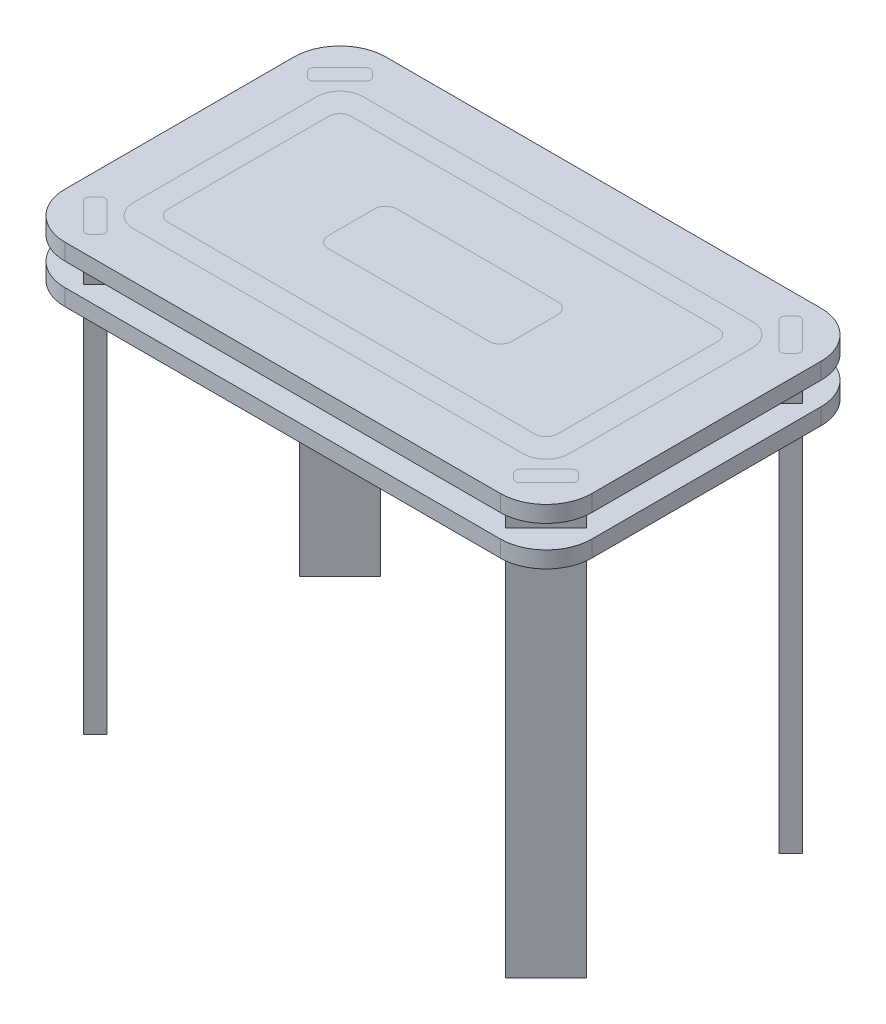
from build123d import *

# Parameters (mm, degrees)
BOSS_EXTRUDE3_DEPTH   = 18.288
BOSS_EXTRUDE3_2_DEPTH = 18.288
BOSS_EXTRUDE4_DEPTH   = 18.288
BOSS_EXTRUDE4_2_DEPTH = 18.288
BOSS_EXTRUDE5_DEPTH   = 18.288
BOSS_EXTRUDE5_2_DEPTH = 18.288
BOSS_EXTRUDE5_3_DEPTH = 18.288
BOSS_EXTRUDE5_4_DEPTH = 18.288
BOSS_EXTRUDE6_DEPTH   = 457.2
BOSS_EXTRUDE6_2_DEPTH = 457.2
BOSS_EXTRUDE6_3_DEPTH = 457.2
BOSS_EXTRUDE6_4_DEPTH = 457.2
BOSS_EXTRUDE7_START   = -18.288
BOSS_EXTRUDE7_DEPTH   = 18.288


with BuildPart() as part:
    # Sketch1 → Boss-Extrude3 (new body)
    with BuildSketch(Plane(origin=(0, 0, 0), x_dir=(1, 0, 0), z_dir=(0, 1, 0))):
        with BuildLine():
            ThreePointArc((0, 50.8), (14.878975516, 14.878975516), (50.8, 0))
            Line((50.8, 0), (533.4, 0))
            ThreePointArc((533.4, 0), (569.321024484, 14.878975516), (584.2, 50.8))
            Line((584.2, 50.8), (584.2, 304.8))
            ThreePointArc((584.2, 304.8), (569.321024484, 340.721024484), (533.4, 355.6))
            Line((533.4, 355.6), (50.8, 355.6))
            ThreePointArc((50.8, 355.6), (14.878975516, 340.721024484), (0, 304.8))
            Line((0, 304.8), (0, 50.8))
        make_face()
        with BuildLine():
            ThreePointArc((57.293126933, 21.372102448), (53.701024484, 19.884204897), (50.108922036, 21.372102448))
            Line((50.108922036, 21.372102448), (21.372102448, 50.108922036))
            ThreePointArc((21.372102448, 50.108922036), (19.884204897, 53.701024484), (21.372102448, 57.293126933))
            Line((21.372102448, 57.293126933), (27.097015726, 63.01804021))
            ThreePointArc((27.097015726, 63.01804021), (30.689118174, 64.505937761), (34.281220622, 63.01804021))
            Line((34.281220622, 63.01804021), (63.01804021, 34.281220622))
            ThreePointArc((63.01804021, 34.281220622), (64.505937761, 30.689118174), (63.01804021, 27.097015726))
            Line((63.01804021, 27.097015726), (57.293126933, 21.372102448))
        make_face(mode=Mode.SUBTRACT)
        with BuildLine():
            Line((526.906873067, 21.372102448), (521.18195979, 27.097015726))
            ThreePointArc((521.18195979, 27.097015726), (519.694062239, 30.689118174), (521.18195979, 34.281220622))
            Line((521.18195979, 34.281220622), (549.918779378, 63.01804021))
            ThreePointArc((549.918779378, 63.01804021), (553.510881826, 64.505937761), (557.102984274, 63.01804021))
            Line((557.102984274, 63.01804021), (562.827897552, 57.293126933))
            ThreePointArc((562.827897552, 57.293126933), (564.315795103, 53.701024484), (562.827897552, 50.108922036))
            Line((562.827897552, 50.108922036), (534.091077964, 21.372102448))
            ThreePointArc((534.091077964, 21.372102448), (530.498975516, 19.884204897), (526.906873067, 21.372102448))
        make_face(mode=Mode.SUBTRACT)
        with BuildLine():
            Line((508, 50.8), (76.2, 50.8))
            ThreePointArc((76.2, 50.8), (58.239487758, 58.239487758), (50.8, 76.2))
            Line((50.8, 76.2), (50.8, 279.4))
            ThreePointArc((50.8, 279.4), (58.239487758, 297.360512242), (76.2, 304.8))
            Line((76.2, 304.8), (508, 304.8))
            ThreePointArc((508, 304.8), (525.960512242, 297.360512242), (533.4, 279.4))
            Line((533.4, 279.4), (533.4, 76.2))
            ThreePointArc((533.4, 76.2), (525.960512242, 58.239487758), (508, 50.8))
        make_face(mode=Mode.SUBTRACT)
        with BuildLine():
            Line((27.097015726, 292.58195979), (21.372102448, 298.306873067))
            ThreePointArc((21.372102448, 298.306873067), (19.884204897, 301.898975516), (21.372102448, 305.491077964))
            Line((21.372102448, 305.491077964), (50.108922036, 334.227897552))
            ThreePointArc((50.108922036, 334.227897552), (53.701024484, 335.715795103), (57.293126933, 334.227897552))
            Line((57.293126933, 334.227897552), (63.01804021, 328.502984274))
            ThreePointArc((63.01804021, 328.502984274), (64.505937761, 324.910881826), (63.01804021, 321.318779378))
            Line((63.01804021, 321.318779378), (34.281220622, 292.58195979))
            ThreePointArc((34.281220622, 292.58195979), (30.689118174, 291.094062239), (27.097015726, 292.58195979))
        make_face(mode=Mode.SUBTRACT)
        with BuildLine():
            ThreePointArc((562.827897552, 305.491077964), (564.315795103, 301.898975516), (562.827897552, 298.306873067))
            Line((562.827897552, 298.306873067), (557.102984274, 292.58195979))
            ThreePointArc((557.102984274, 292.58195979), (553.510881826, 291.094062239), (549.918779378, 292.58195979))
            Line((549.918779378, 292.58195979), (521.18195979, 321.318779378))
            ThreePointArc((521.18195979, 321.318779378), (519.694062239, 324.910881826), (521.18195979, 328.502984274))
            Line((521.18195979, 328.502984274), (526.906873067, 334.227897552))
            ThreePointArc((526.906873067, 334.227897552), (530.498975516, 335.715795103), (534.091077964, 334.227897552))
            Line((534.091077964, 334.227897552), (562.827897552, 305.491077964))
        make_face(mode=Mode.SUBTRACT)
    extrude(amount=BOSS_EXTRUDE3_DEPTH)


with BuildPart() as body_2:
    # Sketch1 → Boss-Extrude3 2 (new body)
    with BuildSketch(Plane(origin=(0, 0, 0), x_dir=(1, 0, 0), z_dir=(0, 1, 0))):
        with BuildLine():
            ThreePointArc((76.2, 88.9), (79.919743879, 79.919743879), (88.9, 76.2))
            Line((88.9, 76.2), (495.3, 76.2))
            ThreePointArc((495.3, 76.2), (504.280256121, 79.919743879), (508, 88.9))
            Line((508, 88.9), (508, 266.7))
            ThreePointArc((508, 266.7), (504.280256121, 275.680256121), (495.3, 279.4))
            Line((495.3, 279.4), (88.9, 279.4))
            ThreePointArc((88.9, 279.4), (79.919743879, 275.680256121), (76.2, 266.7))
            Line((76.2, 266.7), (76.2, 88.9))
        make_face()
        with BuildLine():
            ThreePointArc((190.5, 203.2), (194.219743879, 212.180256121), (203.2, 215.9))
            Line((203.2, 215.9), (381, 215.9))
            ThreePointArc((381, 215.9), (389.980256121, 212.180256121), (393.7, 203.2))
            Line((393.7, 203.2), (393.7, 152.4))
            ThreePointArc((393.7, 152.4), (389.980256121, 143.419743879), (381, 139.7))
            Line((381, 139.7), (203.2, 139.7))
            ThreePointArc((203.2, 139.7), (194.219743879, 143.419743879), (190.5, 152.4))
            Line((190.5, 152.4), (190.5, 203.2))
        make_face(mode=Mode.SUBTRACT)
    extrude(amount=BOSS_EXTRUDE3_2_DEPTH)


with BuildPart() as body_3:
    # Sketch1<6> → Boss-Extrude4 (new body)
    with BuildSketch(Plane(origin=(0, 0, 0), x_dir=(1, 0, 0), z_dir=(0, 1, 0))):
        with BuildLine():
            ThreePointArc((50.8, 76.2), (58.239487758, 58.239487758), (76.2, 50.8))
            Line((76.2, 50.8), (508, 50.8))
            ThreePointArc((508, 50.8), (525.960512242, 58.239487758), (533.4, 76.2))
            Line((533.4, 76.2), (533.4, 279.4))
            ThreePointArc((533.4, 279.4), (525.960512242, 297.360512242), (508, 304.8))
            Line((508, 304.8), (76.2, 304.8))
            ThreePointArc((76.2, 304.8), (58.239487758, 297.360512242), (50.8, 279.4))
            Line((50.8, 279.4), (50.8, 76.2))
        make_face()
        with BuildLine():
            Line((495.3, 76.2), (88.9, 76.2))
            ThreePointArc((88.9, 76.2), (79.919743879, 79.919743879), (76.2, 88.9))
            Line((76.2, 88.9), (76.2, 266.7))
            ThreePointArc((76.2, 266.7), (79.919743879, 275.680256121), (88.9, 279.4))
            Line((88.9, 279.4), (495.3, 279.4))
            ThreePointArc((495.3, 279.4), (504.280256121, 275.680256121), (508, 266.7))
            Line((508, 266.7), (508, 88.9))
            ThreePointArc((508, 88.9), (504.280256121, 79.919743879), (495.3, 76.2))
        make_face(mode=Mode.SUBTRACT)
    extrude(amount=BOSS_EXTRUDE4_DEPTH)


with BuildPart() as body_4:
    # Sketch1<6> → Boss-Extrude4 2 (new body)
    with BuildSketch(Plane(origin=(0, 0, 0), x_dir=(1, 0, 0), z_dir=(0, 1, 0))):
        with BuildLine():
            Line((381, 215.9), (203.2, 215.9))
            ThreePointArc((203.2, 215.9), (194.219743879, 212.180256121), (190.5, 203.2))
            Line((190.5, 203.2), (190.5, 152.4))
            ThreePointArc((190.5, 152.4), (194.219743879, 143.419743879), (203.2, 139.7))
            Line((203.2, 139.7), (381, 139.7))
            ThreePointArc((381, 139.7), (389.980256121, 143.419743879), (393.7, 152.4))
            Line((393.7, 152.4), (393.7, 203.2))
            ThreePointArc((393.7, 203.2), (389.980256121, 212.180256121), (381, 215.9))
        make_face()
    extrude(amount=BOSS_EXTRUDE4_2_DEPTH)


with BuildPart() as body_5:
    # Sketch1<7> → Boss-Extrude5 (new body)
    with BuildSketch(Plane(origin=(0, 0, 0), x_dir=(1, 0, 0), z_dir=(0, 1, 0))):
        with BuildLine():
            ThreePointArc((21.372102448, 305.491077964), (19.884204897, 301.898975516), (21.372102448, 298.306873067))
            Line((21.372102448, 298.306873067), (27.097015726, 292.58195979))
            ThreePointArc((27.097015726, 292.58195979), (30.689118174, 291.094062239), (34.281220622, 292.58195979))
            Line((34.281220622, 292.58195979), (63.01804021, 321.318779378))
            ThreePointArc((63.01804021, 321.318779378), (64.505937761, 324.910881826), (63.01804021, 328.502984274))
            Line((63.01804021, 328.502984274), (57.293126933, 334.227897552))
            ThreePointArc((57.293126933, 334.227897552), (53.701024484, 335.715795103), (50.108922036, 334.227897552))
            Line((50.108922036, 334.227897552), (21.372102448, 305.491077964))
        make_face()
    extrude(amount=BOSS_EXTRUDE5_DEPTH)


with BuildPart() as body_6:
    # Sketch1<7> → Boss-Extrude5 2 (new body)
    with BuildSketch(Plane(origin=(0, 0, 0), x_dir=(1, 0, 0), z_dir=(0, 1, 0))):
        with BuildLine():
            Line((557.102984274, 292.58195979), (562.827897552, 298.306873067))
            ThreePointArc((562.827897552, 298.306873067), (564.315795103, 301.898975516), (562.827897552, 305.491077964))
            Line((562.827897552, 305.491077964), (534.091077964, 334.227897552))
            ThreePointArc((534.091077964, 334.227897552), (530.498975516, 335.715795103), (526.906873067, 334.227897552))
            Line((526.906873067, 334.227897552), (521.18195979, 328.502984274))
            ThreePointArc((521.18195979, 328.502984274), (519.694062239, 324.910881826), (521.18195979, 321.318779378))
            Line((521.18195979, 321.318779378), (549.918779378, 292.58195979))
            ThreePointArc((549.918779378, 292.58195979), (553.510881826, 291.094062239), (557.102984274, 292.58195979))
        make_face()
    extrude(amount=BOSS_EXTRUDE5_2_DEPTH)


with BuildPart() as body_7:
    # Sketch1<7> → Boss-Extrude5 3 (new body)
    with BuildSketch(Plane(origin=(0, 0, 0), x_dir=(1, 0, 0), z_dir=(0, 1, 0))):
        with BuildLine():
            ThreePointArc((521.18195979, 34.281220622), (519.694062239, 30.689118174), (521.18195979, 27.097015726))
            Line((521.18195979, 27.097015726), (526.906873067, 21.372102448))
            ThreePointArc((526.906873067, 21.372102448), (530.498975516, 19.884204897), (534.091077964, 21.372102448))
            Line((534.091077964, 21.372102448), (562.827897552, 50.108922036))
            ThreePointArc((562.827897552, 50.108922036), (564.315795103, 53.701024484), (562.827897552, 57.293126933))
            Line((562.827897552, 57.293126933), (557.102984274, 63.01804021))
            ThreePointArc((557.102984274, 63.01804021), (553.510881826, 64.505937761), (549.918779378, 63.01804021))
            Line((549.918779378, 63.01804021), (521.18195979, 34.281220622))
        make_face()
    extrude(amount=BOSS_EXTRUDE5_3_DEPTH)


with BuildPart() as body_8:
    # Sketch1<7> → Boss-Extrude5 4 (new body)
    with BuildSketch(Plane(origin=(0, 0, 0), x_dir=(1, 0, 0), z_dir=(0, 1, 0))):
        with BuildLine():
            Line((21.372102448, 50.108922036), (50.108922036, 21.372102448))
            ThreePointArc((50.108922036, 21.372102448), (53.701024484, 19.884204897), (57.293126933, 21.372102448))
            Line((57.293126933, 21.372102448), (63.01804021, 27.097015726))
            ThreePointArc((63.01804021, 27.097015726), (64.505937761, 30.689118174), (63.01804021, 34.281220622))
            Line((63.01804021, 34.281220622), (34.281220622, 63.01804021))
            ThreePointArc((34.281220622, 63.01804021), (30.689118174, 64.505937761), (27.097015726, 63.01804021))
            Line((27.097015726, 63.01804021), (21.372102448, 57.293126933))
            ThreePointArc((21.372102448, 57.293126933), (19.884204897, 53.701024484), (21.372102448, 50.108922036))
        make_face()
    extrude(amount=BOSS_EXTRUDE5_4_DEPTH)


with BuildPart() as body_9:
    # Sketch5 → Boss-Extrude6 (new body)
    with BuildSketch(Plane.XZ):
        Polygon((13.289871939, -58.191152545), (58.191152545, -13.289871939), (71.100270719, -26.198990114), (26.198990114, -71.100270719), align=None)
    extrude(amount=BOSS_EXTRUDE6_DEPTH)



with BuildPart() as body_10:
    # Sketch5 → Boss-Extrude6 2 (new body)
    with BuildSketch(Plane.XZ):
        Polygon((558.001009886, -71.100270719), (570.910128061, -58.191152545), (526.008847455, -13.289871939), (513.099729281, -26.198990114), align=None)
    extrude(amount=BOSS_EXTRUDE6_2_DEPTH)


with BuildPart() as body_11:
    # Sketch5 → Boss-Extrude6 3 (new body)
    with BuildSketch(Plane.XZ):
        Polygon((513.099729281, -329.401009886), (558.001009886, -284.499729281), (570.910128061, -297.408847455), (526.008847455, -342.310128061), align=None)
    extrude(amount=BOSS_EXTRUDE6_3_DEPTH)


with BuildPart() as body_12:
    # Sketch5 → Boss-Extrude6 4 (new body)
    with BuildSketch(Plane.XZ):
        Polygon((26.198990114, -284.499729281), (13.289871939, -297.408847455), (58.191152545, -342.310128061), (71.100270719, -329.401009886), align=None)
    extrude(amount=BOSS_EXTRUDE6_4_DEPTH)


with BuildPart() as body_9_1:
    add(body_9.part)

    add(body_10.part)  # Boss-Extrude7 merges body 10

    add(body_11.part)  # Boss-Extrude7 merges body 11

    add(body_12.part)  # Boss-Extrude7 merges body 12
    # Sketch6 → Boss-Extrude7 (add)
    with BuildSketch(Plane(origin=(0, -25.4, 0), x_dir=(1, 0, 0), z_dir=(0, 1, 0)).offset(BOSS_EXTRUDE7_START)):
        with BuildLine():
            Line((50.8, 0), (533.4, 0))
            ThreePointArc((533.4, 0), (569.321024484, 14.878975516), (584.2, 50.8))
            Line((584.2, 50.8), (584.2, 304.8))
            ThreePointArc((584.2, 304.8), (569.321024484, 340.721024484), (533.4, 355.6))
            Line((533.4, 355.6), (50.8, 355.6))
            ThreePointArc((50.8, 355.6), (14.878975516, 340.721024484), (0, 304.8))
            Line((0, 304.8), (0, 50.8))
            ThreePointArc((0, 50.8), (14.878975516, 14.878975516), (50.8, 0))
        make_face()
        Polygon((26.198990114, 284.499729281), (71.100270719, 329.401009886), (58.191152545, 342.310128061), (13.289871939, 297.408847455), align=None, mode=Mode.SUBTRACT)
        Polygon((526.008847455, 342.310128061), (513.099729281, 329.401009886), (558.001009886, 284.499729281), (570.910128061, 297.408847455), align=None, mode=Mode.SUBTRACT)
        Polygon((558.001009886, 71.100270719), (513.099729281, 26.198990114), (526.008847455, 13.289871939), (570.910128061, 58.191152545), align=None, mode=Mode.SUBTRACT)
        Polygon((58.191152545, 13.289871939), (71.100270719, 26.198990114), (26.198990114, 71.100270719), (13.289871939, 58.191152545), align=None, mode=Mode.SUBTRACT)
    extrude(amount=BOSS_EXTRUDE7_DEPTH)


solid = Compound([part.part, body_2.part, body_3.part, body_4.part, body_5.part, body_6.part, body_7.part, body_8.part, body_9_1.part])
